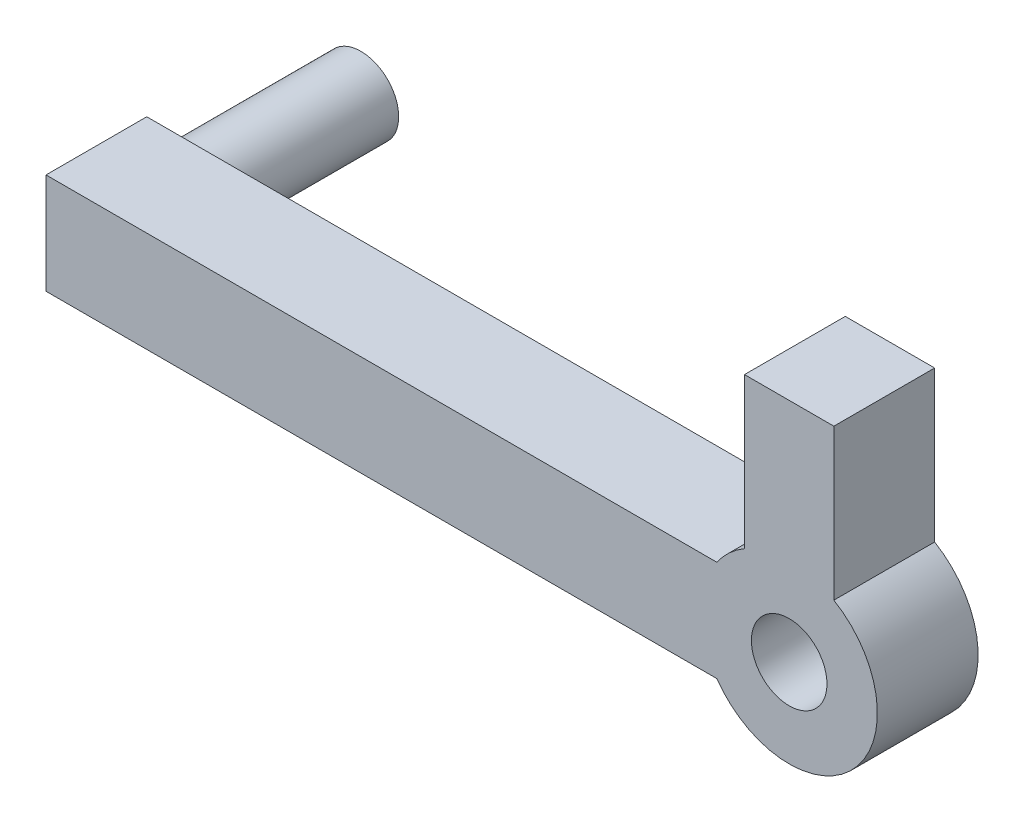
from build123d import *

# Parameters (mm, degrees)
SKETCH1_R           = 7.5
BOSS_EXTRUDE5_DEPTH = 20
SKETCH2_R           = 7.5
BOSS_EXTRUDE6_DEPTH = 35
SKETCH3_W           = 17.737554882
SKETCH3_H           = 20
BOSS_EXTRUDE7_DEPTH = 30


with BuildPart() as part:
    # Sketch1 → Boss-Extrude5 (new body)
    # profile 1 of 6: a face of its own
    with BuildSketch(Plane.XY):
        with BuildLine():
            ThreePointArc((133.138593384, 0), (130, 10), (133.138593384, 20))
            Line((133.138593384, 20), (0, 20))
            Line((0, 20), (0, 10))
            Line((0, 10), (0, 0))
            Line((0, 0), (133.138593384, 0))
        make_face()
        with BuildLine():
            ThreePointArc((15, 10), (7.5, 2.5), (0, 10))
            ThreePointArc((0, 10), (7.5, 17.5), (15, 10))
        make_face(mode=Mode.SUBTRACT)
    # profile 2 of 6: a face of its own
    with BuildSketch(Plane.XY):
        with BuildLine():
            ThreePointArc((147.5, 2.5), (140, 10), (147.5, 17.5))
            Line((147.5, 17.5), (147.5, 20))
            Line((147.5, 20), (133.138593384, 20))
            ThreePointArc((133.138593384, 20), (130, 10), (133.138593384, 0))
            Line((133.138593384, 0), (147.5, 0))
            Line((147.5, 0), (147.5, 2.5))
        make_face()
    # profile 3 of 6: a face of its own
    with BuildSketch(Plane.XY):
        with BuildLine():
            Line((147.5, 20), (147.5, 17.5))
            ThreePointArc((147.5, 17.5), (152.803300859, 15.303300859), (155, 10))
            ThreePointArc((155, 10), (152.803300859, 4.696699141), (147.5, 2.5))
            Line((147.5, 2.5), (147.5, 0))
            Line((147.5, 0), (133.138593384, 0))
            ThreePointArc((133.138593384, 0), (152.740485866, -6.696925103), (165, 10))
            ThreePointArc((165, 10), (152.740485866, 26.696925103), (133.138593384, 20))
            Line((133.138593384, 20), (147.5, 20))
        make_face()
    # profile 4 of 6: a face of its own
    with BuildSketch(Plane.XY):
        with Locations((7.5, 10)):
            Circle(SKETCH1_R)
    # profile 5 of 6: a face of its own
    with BuildSketch(Plane.XY):
        with BuildLine():
            ThreePointArc((147.5, 2.5), (140, 10), (147.5, 17.5))
            Line((147.5, 17.5), (147.5, 20))
            Line((147.5, 20), (133.138593384, 20))
            ThreePointArc((133.138593384, 20), (130, 10), (133.138593384, 0))
            Line((133.138593384, 0), (147.5, 0))
            Line((147.5, 0), (147.5, 2.5))
        make_face()
    # profile 6 of 6: a face of its own
    with BuildSketch(Plane.XY):
        with BuildLine():
            Line((147.5, 20), (147.5, 17.5))
            ThreePointArc((147.5, 17.5), (152.803300859, 15.303300859), (155, 10))
            ThreePointArc((155, 10), (152.803300859, 4.696699141), (147.5, 2.5))
            Line((147.5, 2.5), (147.5, 0))
            Line((147.5, 0), (133.138593384, 0))
            ThreePointArc((133.138593384, 0), (152.740485866, -6.696925103), (165, 10))
            ThreePointArc((165, 10), (152.740485866, 26.696925103), (133.138593384, 20))
            Line((133.138593384, 20), (147.5, 20))
        make_face()
    extrude(amount=BOSS_EXTRUDE5_DEPTH)

    # Sketch2 → Boss-Extrude6 (add)
    with BuildSketch(Plane(origin=(0, 0, 0), x_dir=(-1, 0, 0), z_dir=(0, 0, -1))):
        with Locations((-7.5, 10)):
            Circle(SKETCH2_R)
    extrude(amount=BOSS_EXTRUDE6_DEPTH)

    # Sketch3 → Boss-Extrude7 (add)
    with BuildSketch(Plane(origin=(0, 25, 0), x_dir=(1, 0, 0), z_dir=(0, 1, 0))):
        with Locations((147.498702773, -10)):
            Rectangle(SKETCH3_W, SKETCH3_H)
    extrude(amount=BOSS_EXTRUDE7_DEPTH)


solid = part.part
